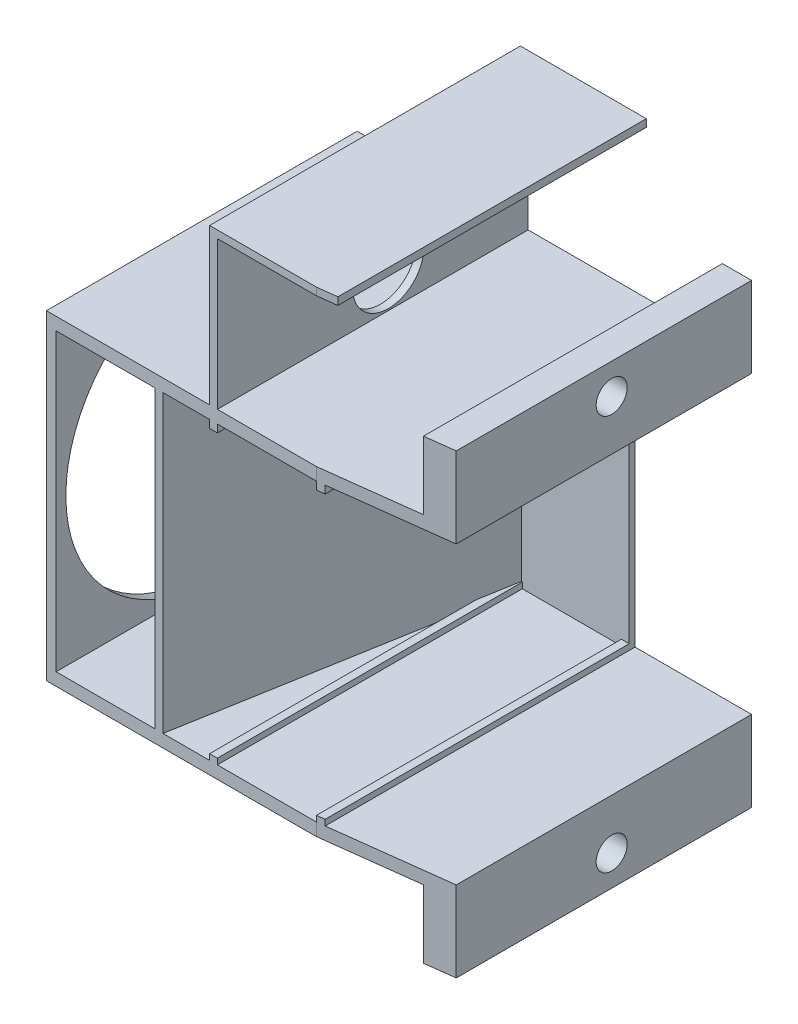
from build123d import *

# Parameters (mm, degrees)
EXTRUDE_1_DEPTH     = 32
EXTRUDE_2_DEPTH     = 30.4
SKETCH_3_W          = 0.8
SKETCH_3_H          = 32
EXTRUDE_3_DEPTH     = 0.6
SKETCH_4_W          = 0.8
SKETCH_4_H          = 32
EXTRUDE_4_DEPTH     = 0.6
SKETCH_5_W          = 11.8
SKETCH_5_H          = 30.4
SKETCH_5_W_2        = 11
EXTRUDE_11_DEPTH    = 0.6
SKETCH_6_R          = 1.6
CUT_EXTRUDE_1_DEPTH = 70.561196079
SKETCH_7_R          = 15
CUT_EXTRUDE_2_DEPTH = 3
SKETCH_8_R          = 3.675878391
CUT_EXTRUDE_3_DEPTH = 10
CUT_EXTRUDE_4_DEPTH = 77.212597384


with BuildPart() as part:
    # 草图1 → 凸台-拉伸1 (new body)
    with BuildSketch(Plane.XY):
        Polygon((-40.6, 33), (-40.6, 0), (-3, 0), (-3, -7), (0, -7), (0, 1.3), (-12, 1.3), (-12, 1.9), (-12.8, 1.9), (-12.8, 1.3), (-23, 1.3), (-23, 1.9), (-23.8, 1.9), (-23.8, 1.3), (-39.6, 1.3), (-39.6, 31.7), (-23.8, 31.7), (-23.8, 30.9), (-23, 30.9), (-23, 31.7), (-12.8, 31.7), (-12.8, 30.9), (-12, 30.9), (-12, 31.7), (0, 31.7), (0, 40), (-3, 40), (-3, 33), (-23, 33), (-23, 48.225966529), (-10.836350524, 48.225966529), (-10.836350524, 49), (-23.8, 49), (-23.8, 33), align=None)
    extrude(amount=EXTRUDE_1_DEPTH)

    # 草图2 → 凸台-拉伸2 (add)
    with BuildSketch(Plane.XZ.offset(-31.7)):
        Polygon((-23.8, 0), (-29.4, 32), (-28.6, 32), (-23, 0), align=None)
    extrude(amount=EXTRUDE_2_DEPTH)

    # 草图3 → 凸台-拉伸3 (add)
    with BuildSketch(Plane.XZ.offset(-31.7)):
        with Locations((-29, 16)):
            Rectangle(SKETCH_3_W, SKETCH_3_H)
    extrude(amount=EXTRUDE_3_DEPTH)

    # 草图4 → 凸台-拉伸4 (add)
    with BuildSketch(Plane(origin=(0, 1.3, 0), x_dir=(1, 0, 0), z_dir=(0, 1, 0))):
        with Locations((-29, -16)):
            Rectangle(SKETCH_4_W, SKETCH_4_H)
    extrude(amount=EXTRUDE_4_DEPTH)

    # 草图5 → 凸台-拉伸11 (add)
    with BuildSketch(Plane(origin=(0, 0, 0), x_dir=(-1, 0, 0), z_dir=(0, 0, -1))):
        with Locations((17.9, 16.5)):
            Rectangle(SKETCH_5_W, SKETCH_5_H)
        with Locations((34.1, 16.5)):
            Rectangle(SKETCH_5_W_2, SKETCH_5_H)
    extrude(amount=-EXTRUDE_11_DEPTH)

    # 草图6 → 切除-拉伸1 (cut, through all)
    with BuildSketch(Plane.ZY.offset(3)):
        with Locations((14.4, 36.855019001)):
            Circle(SKETCH_6_R)
        with Locations(Location((14.4, -3.855019001, 0), (0, 0, 180))):
            Circle(SKETCH_6_R)
    extrude(amount=-CUT_EXTRUDE_1_DEPTH, mode=Mode.SUBTRACT)

    # 草图7 → 切除-拉伸2 (cut)
    with BuildSketch(Plane.ZY.offset(40.6)):
        with Locations((16, 16.5)):
            Circle(SKETCH_7_R)
    extrude(amount=-CUT_EXTRUDE_2_DEPTH, mode=Mode.SUBTRACT)

    # 草图8 → 切除-拉伸3 (cut)
    with BuildSketch(Plane.ZY.offset(23.8)):
        with Locations((14.4, 36.855019001)):
            Circle(SKETCH_8_R)
    extrude(amount=-CUT_EXTRUDE_3_DEPTH, mode=Mode.SUBTRACT)

    # 草图9 → 切除-拉伸4 (cut, through all)
    with BuildSketch(Plane.XZ.offset(7)):
        Polygon((-12.8, 32), (0.069065174, 32), (0.069065174, 30.4), align=None)
    extrude(amount=-CUT_EXTRUDE_4_DEPTH, mode=Mode.SUBTRACT)


solid = part.part
